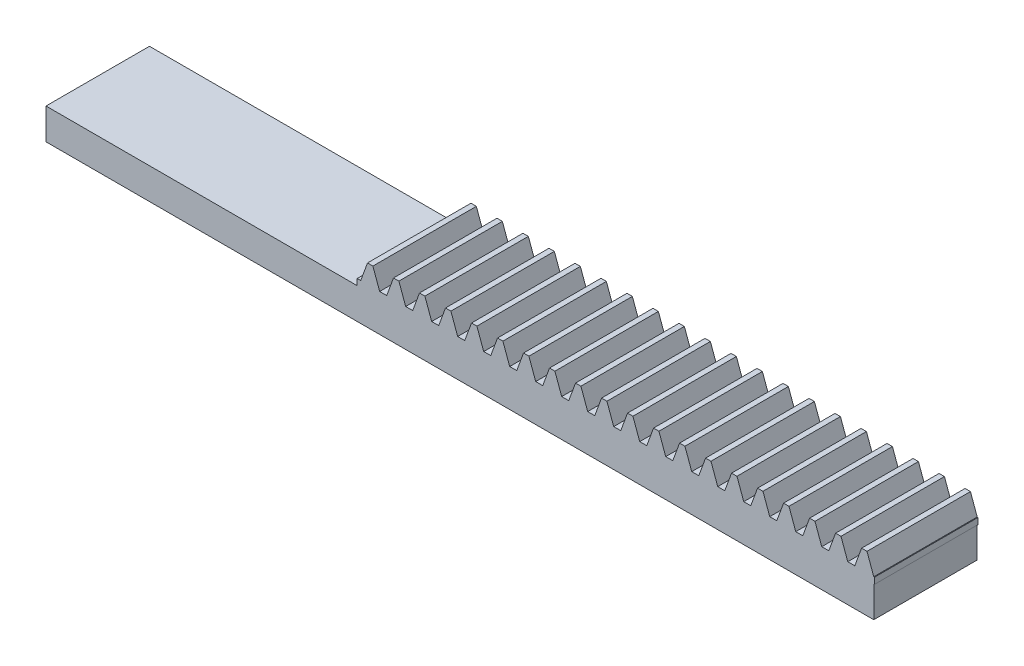
from build123d import *

# Parameters (mm, degrees)
BLANKSKE_W          = 500
BLANKSKE_H          = 24
BLANK_DEPTH         = 100
TOOTHCUTSIM_DEPTH   = 511.466453354
TEETHCUTS_COUNT     = 21
TEETHCUTS_PITCH     = 25.1327412
SKETCH1_W           = 800
SKETCH1_H           = 100
BOSS_EXTRUDE1_DEPTH = 30


with BuildPart() as part:
    # BlankSke → Blank (new body)
    with BuildSketch(Plane.XY):
        with Locations((250, 12)):
            Rectangle(BLANKSKE_W, BLANKSKE_H)
    extrude(amount=-BLANK_DEPTH)

    # TooCutSkeSim → ToothCutSim (cut, through all)
    with BuildSketch(Plane.XY):
        Polygon((3.408482957, 6), (-3.408482957, 6), (-9.969192018, 24.0254), (9.969192018, 24.0254), align=None)
    toothcutsim = extrude(amount=-TOOTHCUTSIM_DEPTH, mode=Mode.SUBTRACT)

    # TeethCuts: ToothCutSim ×21
    with Locations(*[(i * TEETHCUTS_PITCH, 0, 0) for i in range(1, TEETHCUTS_COUNT)]):
        add(toothcutsim, mode=Mode.SUBTRACT)

    # Sketch1 → Boss-Extrude1 (add)
    with BuildSketch(Plane.XZ):
        with Locations((99.246341043, -50)):
            Rectangle(SKETCH1_W, SKETCH1_H)
    extrude(amount=BOSS_EXTRUDE1_DEPTH)


solid = part.part
